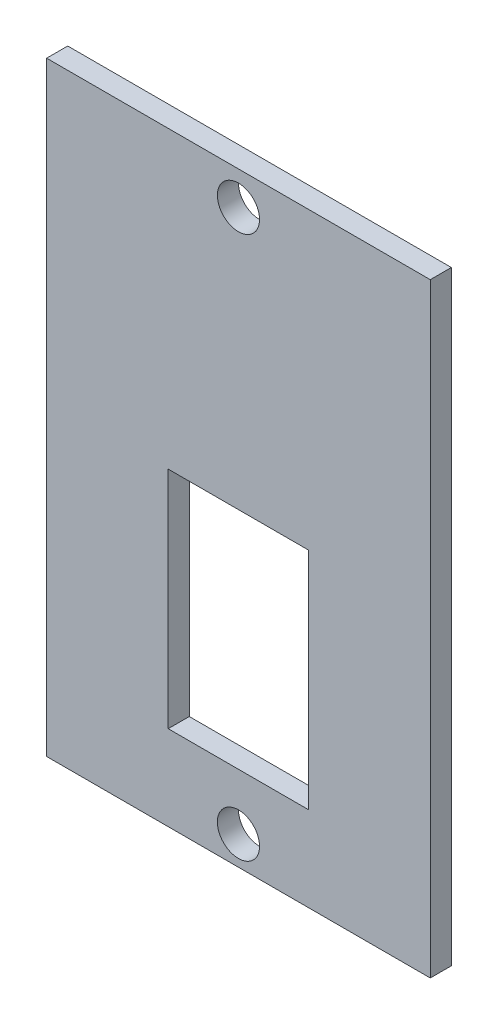
from build123d import *

# Parameters (mm, degrees)
SKETCH_1_R          = 1.5
SKETCH_1_W          = 10
SKETCH_1_H          = 16
EXTRUDE_1_DEPTH     = 1.5
SKETCH_2_R          = 1.5
CUT_EXTRUDE_1_DEPTH = 10


with BuildPart() as part:
    # 草图1 → 凸台-拉伸1 (new body)
    # profile 1 of 2: a face of its own
    with BuildSketch(Plane.XY):
        Polygon((-13.65, 28.439884515), (-13.65, 14.6), (-13.65, -14.6), (13.65, -14.6), (13.65, 14.6), (13.65, 28.439884515), align=None)
        with Locations((0, -12.560115485)):
            Circle(SKETCH_1_R, mode=Mode.SUBTRACT)
        with Locations((0, -0.560115485)):
            Rectangle(SKETCH_1_W, SKETCH_1_H, mode=Mode.SUBTRACT)
    # profile 2 of 2: a face of its own
    with BuildSketch(Plane.XY):
        Polygon((-13.65, 28.439884515), (-13.65, 14.6), (-13.65, -14.6), (13.65, -14.6), (13.65, 14.6), (13.65, 28.439884515), align=None)
        with Locations((0, -12.560115485)):
            Circle(SKETCH_1_R, mode=Mode.SUBTRACT)
        with Locations((0, -0.560115485)):
            Rectangle(SKETCH_1_W, SKETCH_1_H, mode=Mode.SUBTRACT)
    extrude(amount=EXTRUDE_1_DEPTH)

    # 草图2 → 切除-拉伸1 (cut)
    with BuildSketch(Plane(origin=(0, 0, 0), x_dir=(-1, 0, 0), z_dir=(0, 0, -1))):
        with Locations((0, 26.068537202)):
            Circle(SKETCH_2_R)
    extrude(amount=-CUT_EXTRUDE_1_DEPTH, mode=Mode.SUBTRACT)


solid = part.part
